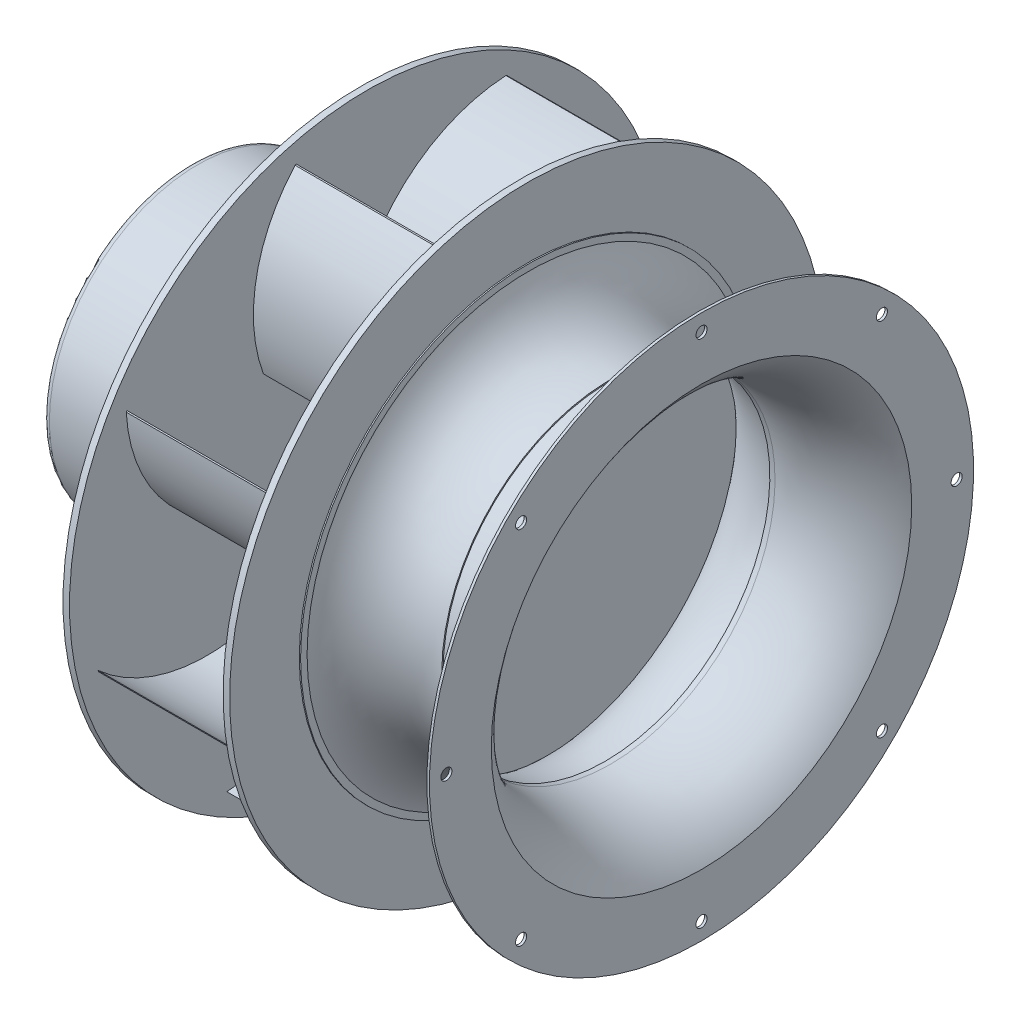
from build123d import *

# Parameters (mm, degrees)
SKETCH2_R         = 228.5
EXTRUDE1_DEPTH    = 5
SKETCH9_R         = 223.5
SKETCH9_R_2       = 100
EXTRUDE7_DEPTH    = 3
SKETCH3_R         = 228.5
EXTRUDE2_DEPTH    = 5
EXTRUDE3_DEPTH    = 123
CIRPATTERN1_COUNT = 8
SKETCH7_R         = 4.25
EXTRUDE5_DEPTH    = 5
CIRPATTERN2_COUNT = 8
SKETCH8_R         = 5
EXTRUDE6_DEPTH    = 90
CIRPATTERN3_COUNT = 8


with BuildPart() as part:
    # Sketch1 → Revolve1 (revolve)
    with BuildSketch(Plane.XY, mode=Mode.PRIVATE) as revolve1_sk:
        with BuildLine():
            Line((0, 0), (0, 109))
            ThreePointArc((0, 109), (1.464466094, 112.535533906), (5, 114))
            Line((5, 114), (70, 114))
            Line((70, 114), (70, 138))
            Line((70, 138), (90, 138))
            Line((90, 138), (90, 98))
            Line((90, 98), (95, 98))
            Line((95, 98), (95, 133))
            Line((95, 133), (105, 133))
            Line((105, 133), (105, 98))
            Line((105, 98), (130, 98))
            Line((130, 98), (130, 0))
            Line((130, 0), (0, 0))
        make_face()
    revolve(revolve1_sk.sketch.rotate(Axis((0, 0, 0), (1, 0, 0)), 90), axis=Axis((0, 0, 0), (1, 0, 0)))

    # Sketch2 → Extrude1 (add)
    with BuildSketch(Plane(origin=(130, 0, 0), x_dir=(0, 0, -1), z_dir=(1, 0, 0))):
        Circle(SKETCH2_R)
    extrude(amount=EXTRUDE1_DEPTH)

    # Sketch9 → Extrude7 (cut)
    with BuildSketch(Plane.ZY.offset(-130)):
        Circle(SKETCH9_R)
        Circle(SKETCH9_R_2, mode=Mode.SUBTRACT)
    extrude(amount=-EXTRUDE7_DEPTH, mode=Mode.SUBTRACT)



with BuildPart() as body_2:
    # Sketch3 → Extrude2 (new body)
    with BuildSketch(Plane(origin=(253, 0, 0), x_dir=(0, 0, -1), z_dir=(1, 0, 0))):
        Circle(SKETCH3_R)
    extrude(amount=EXTRUDE2_DEPTH)


with BuildPart() as part_1:
    add(part.part)

    add(body_2.part)  # Extrude3 merges body 2
    # Sketch4 → Extrude3 (add)
    with BuildSketch(Plane(origin=(135, 0, 0), x_dir=(0, 0, -1), z_dir=(1, 0, 0))):
        with BuildLine():
            Line((0, 112.5), (0.866025404, 112))
            ThreePointArc((0.866025404, 112), (44.181969378, 163.030494663), (107.616025404, 184.396423708))
            Line((107.616025404, 184.396423708), (106.75, 184.896423708))
            ThreePointArc((106.75, 184.896423708), (43.315943974, 163.530494663), (0, 112.5))
        make_face()
    extrude3 = extrude(amount=EXTRUDE3_DEPTH)

    # CirPattern1: Extrude3 ×8 about axis
    cirpattern1_axis = Axis((0, 0, 0), (1, 0, 0))
    for i in range(1, CIRPATTERN1_COUNT):
        add(extrude3.rotate(cirpattern1_axis, i * 360 / CIRPATTERN1_COUNT))

    # Sketch5 → Revolve2 (revolve)
    with BuildSketch(Plane.XY, mode=Mode.PRIVATE) as revolve2_sk:
        with BuildLine():
            Line((258, 175), (259, 175))
            Line((259, 175), (259, 170))
            ThreePointArc((259, 170), (283.404989906, 138.713317632), (322, 129.5))
            Line((322, 129.5), (322, 128.5))
            ThreePointArc((322, 128.5), (282.556555543, 137.770953127), (258, 170))
            Line((258, 170), (258, 175))
        make_face()
    revolve(revolve2_sk.sketch.rotate(Axis((0, 0, 0), (1, 0, 0)), 90), axis=Axis((0, 0, 0), (1, 0, 0)))

    # Sketch8 → Extrude6 (cut)
    with BuildSketch(Plane(origin=(0, 0, 0), x_dir=(0, 0, -1), z_dir=(1, 0, 0))):
        with Locations(Location((0, 126, 0), (0, 0, 180))):
            Circle(SKETCH8_R)
    extrude6 = extrude(amount=EXTRUDE6_DEPTH, mode=Mode.SUBTRACT)

    # CirPattern3: Extrude6 ×8 about axis
    cirpattern3_axis = Axis((0, 0, 0), (1, 0, 0))
    for i in range(1, CIRPATTERN3_COUNT):
        add(extrude6.rotate(cirpattern3_axis, i * 360 / CIRPATTERN3_COUNT), mode=Mode.SUBTRACT)


with BuildPart() as body_2_2:
    # Sketch6 → Revolve3 (revolve)
    with BuildSketch(Plane.XY, mode=Mode.PRIVATE) as revolve3_sk:
        with BuildLine():
            Line((392, 209), (390, 209))
            Line((390, 209), (390, 161.5))
            ThreePointArc((390, 161.5), (360.14303751, 136.462831797), (322, 128.5))
            Line((322, 128.5), (318, 128.5))
            Line((318, 128.5), (318, 126.5))
            Line((318, 126.5), (322, 126.5))
            ThreePointArc((322, 126.5), (361.572120087, 134.855759827), (392, 161.5))
            Line((392, 161.5), (392, 209))
        make_face()
    revolve(revolve3_sk.sketch.rotate(Axis((0, 0, 0), (1, 0, 0)), 180), axis=Axis((0, 0, 0), (1, 0, 0)))

    # Sketch7 → Extrude5 (cut)
    with BuildSketch(Plane(origin=(392, 0, 0), x_dir=(0, 0, -1), z_dir=(1, 0, 0))):
        with Locations((0, 196)):
            Circle(SKETCH7_R)
    extrude5 = extrude(amount=-EXTRUDE5_DEPTH, mode=Mode.SUBTRACT)

    # CirPattern2: Extrude5 ×8 about axis
    cirpattern2_axis = Axis((0, 0, 0), (1, 0, 0))
    for i in range(1, CIRPATTERN2_COUNT):
        add(extrude5.rotate(cirpattern2_axis, i * 360 / CIRPATTERN2_COUNT), mode=Mode.SUBTRACT)


solid = Compound([part_1.part, body_2_2.part])
